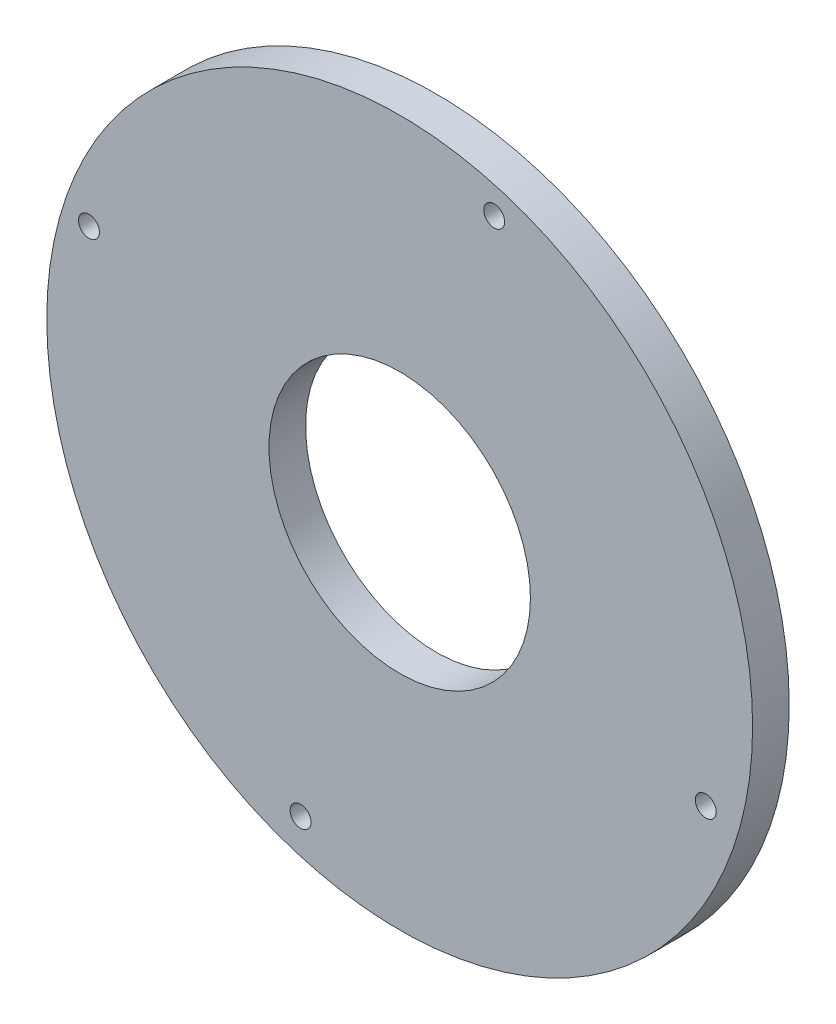
from build123d import *

# Parameters (mm, degrees)
SCHIZZO1_R        = 135
ESTRUSIONE1_DEPTH = 7
SCHIZZO2_R        = 50
SCHIZZO2_R_2      = 4
ESTRUSIONE2_DEPTH = 192.431449872


with BuildPart() as part:
    # Schizzo1 → Estrusione1 (new, symmetric)
    with BuildSketch(Plane.XY):
        Circle(SCHIZZO1_R)
    extrude(amount=ESTRUSIONE1_DEPTH, both=True)

    # Schizzo2 → Estrusione2 (cut, through all)
    with BuildSketch(Plane.XY.offset(7)):
        Circle(SCHIZZO2_R)
        with Locations((-118.84774905, 38.732577319)):
            Circle(SCHIZZO2_R_2)
        with Locations((36.145364343, 119.659987617)):
            Circle(SCHIZZO2_R_2)
        with Locations((117.072774642, -35.333125777)):
            Circle(SCHIZZO2_R_2)
        with Locations((-37.920338752, -116.260536075)):
            Circle(SCHIZZO2_R_2)
    extrude(amount=-ESTRUSIONE2_DEPTH, mode=Mode.SUBTRACT)


solid = part.part
